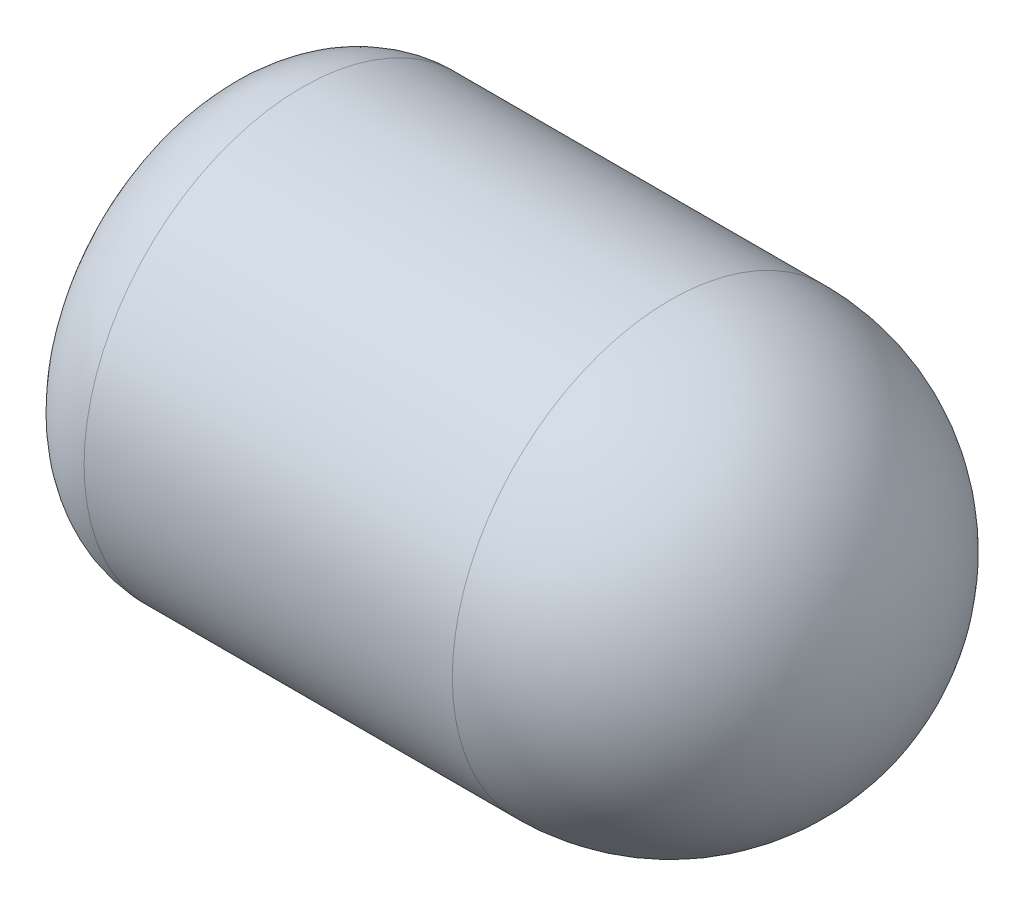
from build123d import *

# Parameters (mm, degrees)
CONG_1_R = 3


with BuildPart() as part:
    # Esquisse2 → Révolution1 (revolve)
    with BuildSketch(Plane.XY, mode=Mode.PRIVATE) as r_volution1_sk:
        with BuildLine():
            Line((0, 3.1), (0, 0))
            Line((0, 0), (7.1, 0))
            ThreePointArc((7.1, 0), (5.020458146, 5.020458146), (0, 7.1))
            Line((0, 7.1), (-15, 7.1))
            Line((-15, 7.1), (-15, 3.1))
            Line((-15, 3.1), (0, 3.1))
        make_face()
    revolve(r_volution1_sk.sketch.rotate(Axis((-13.030068917, 0, 0), (1, 0, 0)), 90), axis=Axis((-13.030068917, 0, 0), (1, 0, 0)))

    # Congé1
    cong_1_edges = [part.edges().sort_by_distance(p)[0] for p in [
        (-15, 0, -7.1),
    ]]
    fillet(cong_1_edges, radius=CONG_1_R)


solid = part.part
